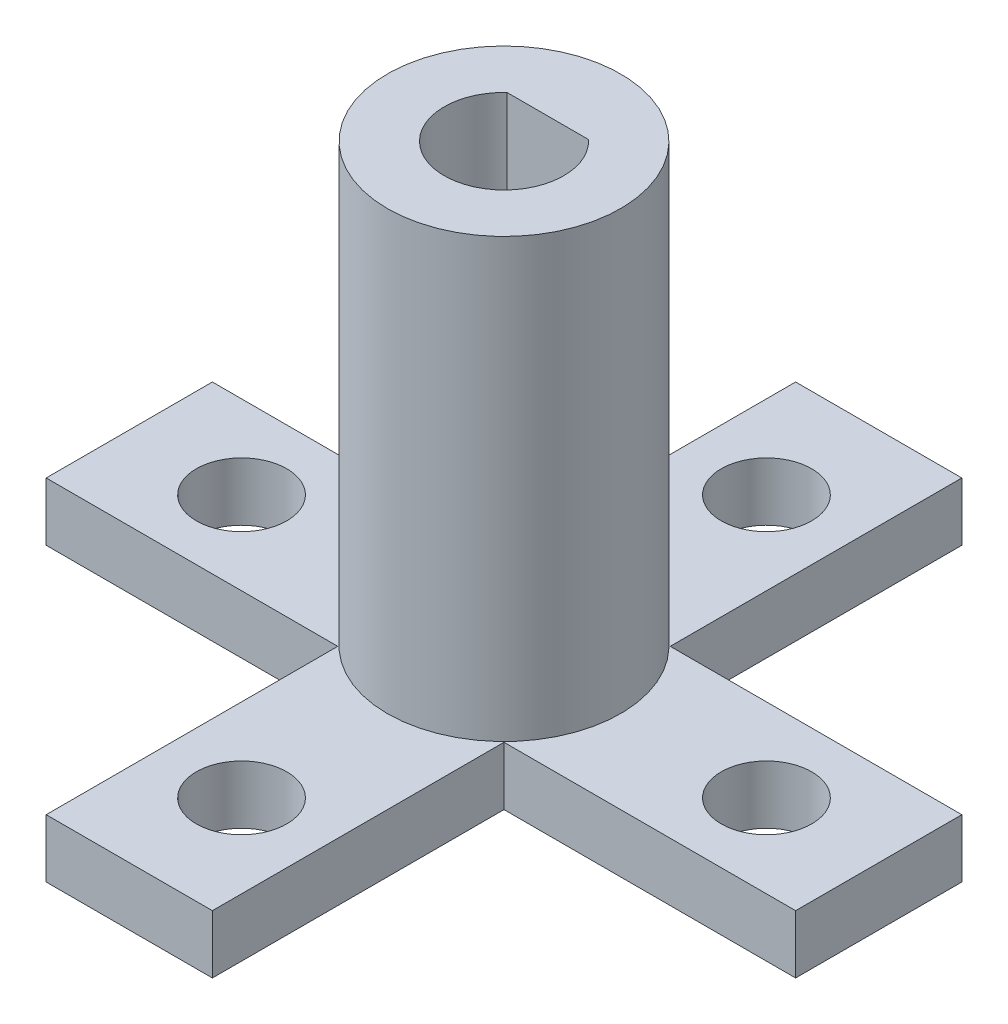
from build123d import *

# Parameters (mm, degrees)
SKETCH_1_W          = 25.7
SKETCH_1_H          = 5.7
SKETCH_1_R          = 1.55
SKETCH_1_W_2        = 5.7
SKETCH_1_H_2        = 25.7
EXTRUDE_1_DEPTH     = 2
SKETCH_2_R          = 4
EXTRUDE_2_DEPTH     = 15
CUT_EXTRUDE_1_DEPTH = 25.884633813
SKETCH_4_R          = 1.5
CUT_EXTRUDE_2_DEPTH = 26.691340954
CUT_EXTRUDE_START   = -1
SKETCH_5_R          = 1.5
CUT_EXTRUDE_3_DEPTH = 1


with BuildPart() as part:
    # 草图1 → 凸台-拉伸1 (new body)
    # profile 1 of 2: a face of its own
    with BuildSketch(Plane(origin=(0, 0, 0), x_dir=(1, 0, 0), z_dir=(0, 1, 0))):
        Rectangle(SKETCH_1_W, SKETCH_1_H)
        with Locations(Location((9, 0, 0), (0, 0, 270))):
            Circle(SKETCH_1_R, mode=Mode.SUBTRACT)
        with Locations(Location((-9, 0, 0), (0, 0, 270))):
            Circle(SKETCH_1_R, mode=Mode.SUBTRACT)
    # profile 2 of 2: a face of its own
    with BuildSketch(Plane(origin=(0, 0, 0), x_dir=(1, 0, 0), z_dir=(0, 1, 0))):
        Rectangle(SKETCH_1_W_2, SKETCH_1_H_2)
        with Locations(Location((0, 9, 0), (0, 0, 270))):
            Circle(SKETCH_1_R, mode=Mode.SUBTRACT)
        with Locations(Location((0, -9, 0), (0, 0, 270))):
            Circle(SKETCH_1_R, mode=Mode.SUBTRACT)
    extrude(amount=EXTRUDE_1_DEPTH)

    # 草图2 → 凸台-拉伸2 (add)
    with BuildSketch(Plane(origin=(0, 2, 0), x_dir=(1, 0, 0), z_dir=(0, 1, 0))):
        with Locations(Location((0, 0, 0), (0, 0, 270))):
            Circle(SKETCH_2_R)
    extrude(amount=EXTRUDE_2_DEPTH)

    # 草图3 → 切除-拉伸1 (cut, through all)
    with BuildSketch(Plane(origin=(0, 17, 0), x_dir=(1, 0, 0), z_dir=(0, 1, 0))):
        with BuildLine():
            Line((0, 1.5), (-1.397318861, 1.5))
            ThreePointArc((-1.397318861, 1.5), (-0.817923081, -1.879761111), (2.05, 0))
            ThreePointArc((2.05, 0), (1.879761111, 0.817923081), (1.397318861, 1.5))
            Line((1.397318861, 1.5), (0, 1.5))
        make_face()
    extrude(amount=-CUT_EXTRUDE_1_DEPTH, mode=Mode.SUBTRACT)

    # 草图4 → 切除-拉伸2 (cut, through all)
    with BuildSketch(Plane.XY.offset(-1.5)):
        with Locations(Location((0, 13, 0), (0, 0, 21.322909655))):
            Circle(SKETCH_4_R)
    extrude(amount=-CUT_EXTRUDE_2_DEPTH, mode=Mode.SUBTRACT)

    # 草图5 → 切除-拉伸3 (cut)
    with BuildSketch(Plane(origin=(0, 0, -1.5), x_dir=(-1, 0, 0), z_dir=(0, 0, -1)).offset(CUT_EXTRUDE_START)):
        with Locations(Location((0, 13, 0), (0, 0, 158.677090345))):
            Circle(SKETCH_5_R)
    extrude(amount=CUT_EXTRUDE_3_DEPTH, mode=Mode.SUBTRACT)


solid = part.part
